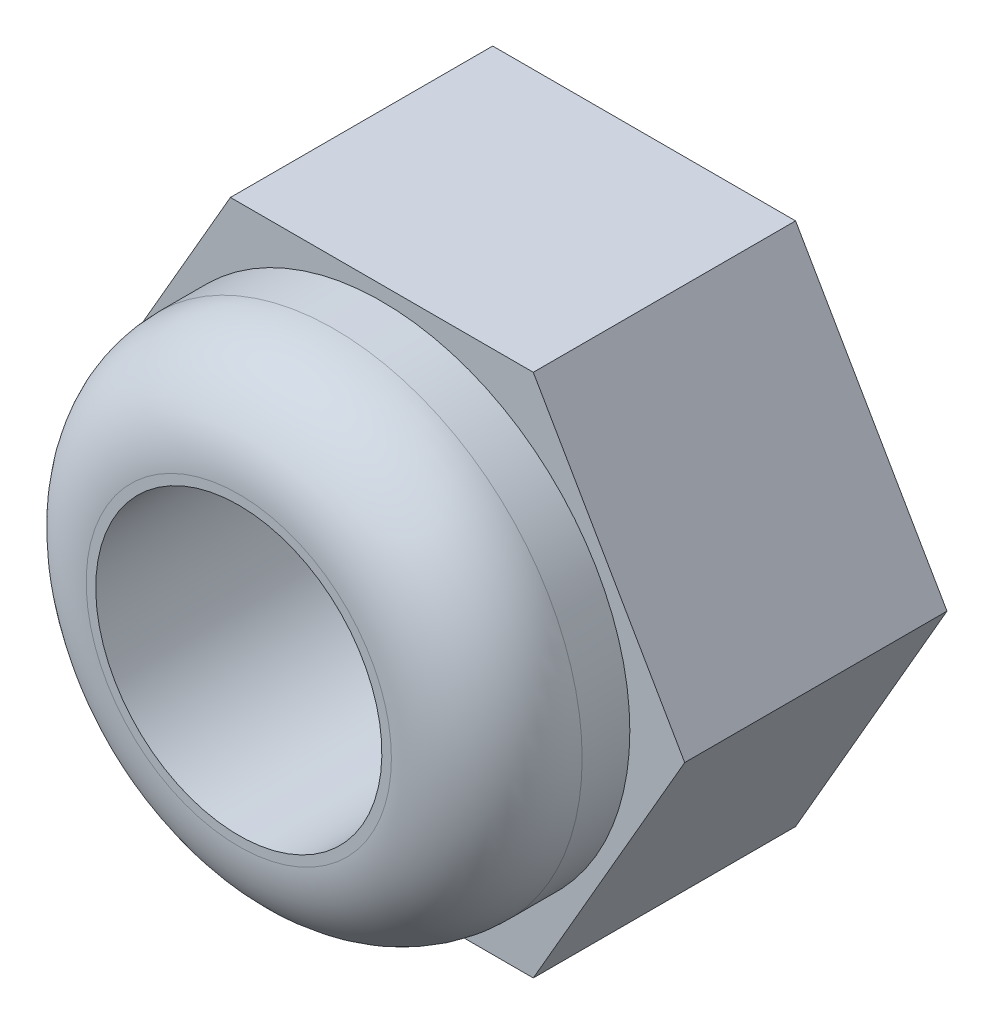
from build123d import *

# Parameters (mm, degrees)
EXTRUDE_1_DEPTH       = 2.75
SKETCH_2_W            = 2.6
SKETCH_2_H            = 1.5
HOLE_WIZARD_3_0_3_1_D = 3
FILLET_1_R            = 1


with BuildPart() as part:
    # 草图1 → 凸台-拉伸1 (new body)
    with BuildSketch(Plane.XY.offset(2.75)):
        Polygon((1.58771324, -2.75), (3.175426481, 0), (1.58771324, 2.75), (-1.58771324, 2.75), (-3.175426481, 0), (-1.58771324, -2.75), align=None)
    extrude(amount=-EXTRUDE_1_DEPTH)

    # 草图2 → 旋转1 (revolve)
    with BuildSketch(Plane(origin=(0, 0, 0), x_dir=(1, 0, 0), z_dir=(0, 1, 0))):
        with Locations((1.3, -3.5)):
            Rectangle(SKETCH_2_W, SKETCH_2_H)
    revolve(axis=Axis((0, 0, 2.75), (0, 0, 1)))

    # Ø3.0 (3) 直径孔1 (through all)
    with Locations(Plane(origin=(0, 0, 0), x_dir=(-1, 0, 0), z_dir=(0, 0, -1))):
        with Locations((0, 0)):
            Hole(HOLE_WIZARD_3_0_3_1_D / 2)

    # 圆角1
    fillet_1_edges = [part.edges().sort_by_distance(p)[0] for p in [
        (-2.6, 0, 4.25),
    ]]
    fillet(fillet_1_edges, radius=FILLET_1_R)


solid = part.part
